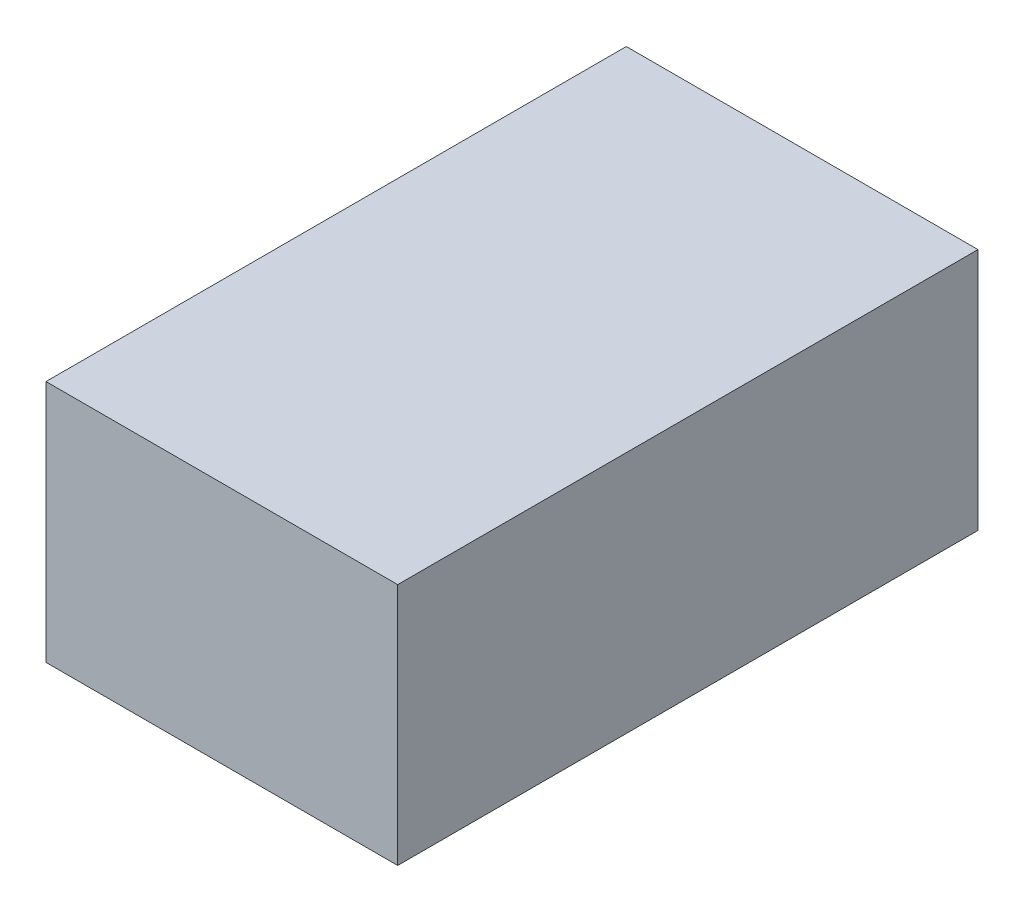
from build123d import *

# Parameters (mm, degrees)
SKETCH1_W           = 120
SKETCH1_H           = 83
BOSS_EXTRUDE1_DEPTH = 198


with BuildPart() as part:
    # Sketch1 → Boss-Extrude1 (new body)
    with BuildSketch(Plane.XY):
        Rectangle(SKETCH1_W, SKETCH1_H)
    extrude(amount=BOSS_EXTRUDE1_DEPTH)


solid = part.part
